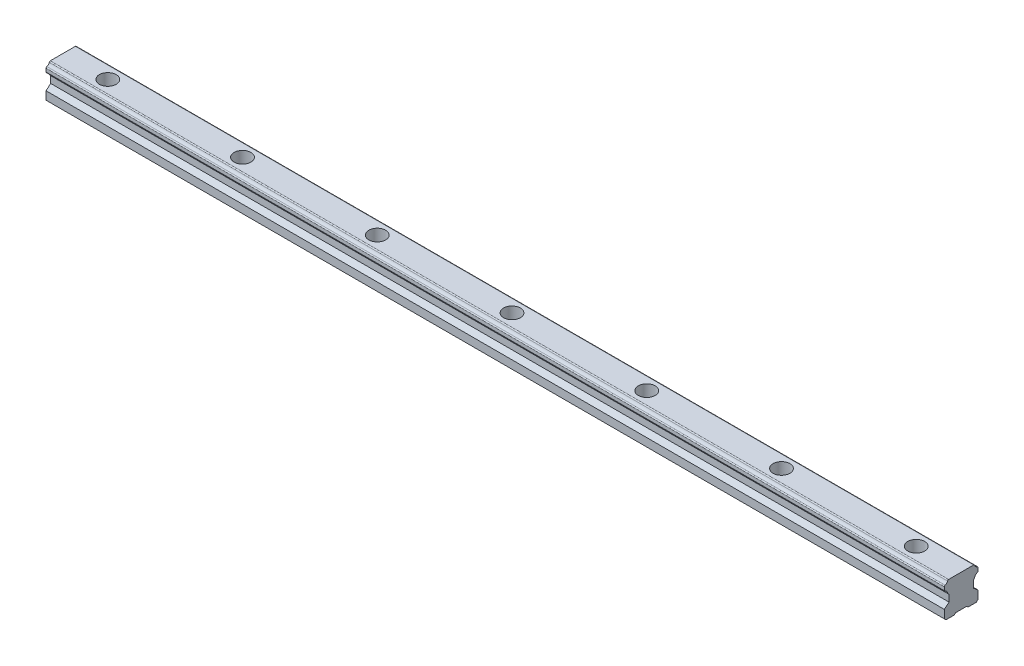
from build123d import *

# Parameters (mm, degrees)
SKETCH_1_W             = 15
SKETCH_1_H             = 15
EXTRUDE_1_DEPTH        = 200
CHAMFER_1_SIZE         = 0.75
SKETCH_3_R             = 3.74995
CUT_EXTRUDE_2_DEPTH    = 5.3
SKETCH_4_R             = 2.25
CUT_EXTRUDE_3_DEPTH    = 201.375497504
PATTERN_LINEAR_1_COUNT = 7
PATTERN_LINEAR_1_PITCH = 60
CUT_EXTRUDE_4_DEPTH    = 401.140600289
CUT_EXTRUDE_5_DEPTH    = 401.140600289
FILLET_1_R             = 0.5
CUT_EXTRUDE_6_DEPTH    = 401.140600289


with BuildPart() as part:
    # 草图1 → 凸台-拉伸1 (new, symmetric)
    with BuildSketch(Plane(origin=(0, 0, 0), x_dir=(0, 0, -1), z_dir=(1, 0, 0))):
        Rectangle(SKETCH_1_W, SKETCH_1_H)
    extrude(amount=EXTRUDE_1_DEPTH, both=True)

    # 倒角1
    chamfer_1_edges = [part.edges().sort_by_distance(p)[0] for p in [
        (0, -7.5, -7.5),
        (0, -7.5, 7.5),
    ]]
    chamfer(chamfer_1_edges, length=CHAMFER_1_SIZE)

    # 草图3 → 切除-拉伸2 (cut)
    with BuildSketch(Plane(origin=(0, 7.5, 0), x_dir=(1, 0, 0), z_dir=(0, 1, 0))):
        with Locations(Location((-180, 0, 0), (0, 0, 270))):
            Circle(SKETCH_3_R)
    cut_extrude_2 = extrude(amount=-CUT_EXTRUDE_2_DEPTH, mode=Mode.SUBTRACT)

    # 草图4 → 切除-拉伸3 (cut, through all)
    with BuildSketch(Plane(origin=(0, 2.2, 0), x_dir=(1, 0, 0), z_dir=(0, 1, 0))):
        with Locations(Location((-180, 0, 0), (0, 0, 270))):
            Circle(SKETCH_4_R)
    cut_extrude_3 = extrude(amount=-CUT_EXTRUDE_3_DEPTH, mode=Mode.SUBTRACT)

    # 阵列(线性)1: 切除-拉伸2, 切除-拉伸3 ×7
    with Locations(*[(i * PATTERN_LINEAR_1_PITCH, 0, 0) for i in range(1, PATTERN_LINEAR_1_COUNT)]):
        add(cut_extrude_2, mode=Mode.SUBTRACT)
        add(cut_extrude_3, mode=Mode.SUBTRACT)

    # 草图2 → 切除-拉伸4 (cut, through all)
    with BuildSketch(Plane(origin=(200, 0, 0), x_dir=(0, 0, -1), z_dir=(1, 0, 0))):
        with BuildLine():
            Line((-7.5, 7.5), (-6, 7.5))
            ThreePointArc((-6, 7.5), (-6.439339828, 6.439339828), (-7.5, 6))
            Line((-7.5, 6), (-7.5, 7.5))
        make_face()
        with BuildLine():
            Line((7.5, 7.5), (7.5, 6))
            ThreePointArc((7.5, 6), (6.439339828, 6.439339828), (6, 7.5))
            Line((6, 7.5), (7.5, 7.5))
        make_face()
    extrude(amount=-CUT_EXTRUDE_4_DEPTH, mode=Mode.SUBTRACT)

    # 草图5 → 切除-拉伸5 (cut, through all)
    with BuildSketch(Plane(origin=(200, 0, 0), x_dir=(0, 0, -1), z_dir=(1, 0, 0))):
        with BuildLine():
            Line((-6, 2.25), (-5.4, 1.65))
            Line((-5.4, 1.65), (-5.4, -1.35))
            Line((-5.4, -1.35), (-7.5, -3.1))
            Line((-7.5, -3.1), (-7.5, 3.75))
            ThreePointArc((-7.5, 3.75), (-6.439339828, 3.310660172), (-6, 2.25))
        make_face()
        with BuildLine():
            Line((7.5, 3.75), (7.5, -3.1))
            Line((7.5, -3.1), (5.4, -1.35))
            Line((5.4, -1.35), (5.4, 1.65))
            Line((5.4, 1.65), (6, 2.25))
            ThreePointArc((6, 2.25), (6.439339828, 3.310660172), (7.5, 3.75))
        make_face()
    extrude(amount=-CUT_EXTRUDE_5_DEPTH, mode=Mode.SUBTRACT)

    # 圆角1
    fillet_1_edges = [part.edges().sort_by_distance(p)[0] for p in [
        (0, 3.75, -7.5),
        (0, 6, 7.5),
        (0, 7.5, 6),
        (0, 7.5, -6),
        (0, 6, -7.5),
        (0, 3.75, 7.5),
    ]]
    fillet(fillet_1_edges, radius=FILLET_1_R)

    # 草图6 → 切除-拉伸6 (cut, through all)
    with BuildSketch(Plane.ZY.offset(200)):
        Polygon((-3.1, -7.5), (-2.5, -6.9), (2.5, -6.9), (3.1, -7.5), align=None)
    extrude(amount=-CUT_EXTRUDE_6_DEPTH, mode=Mode.SUBTRACT)


solid = part.part
